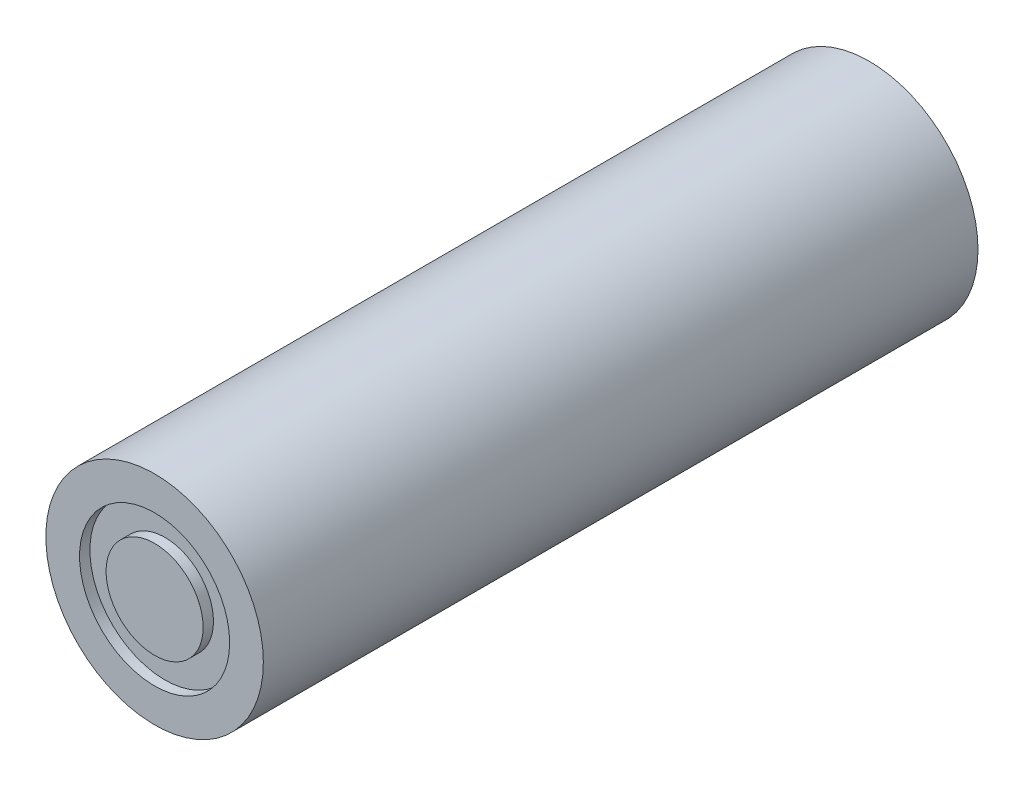
from build123d import *

# Parameters (mm, degrees)
SKETCH1_R           = 10.674999986
BOSS_EXTRUDE1_DEPTH = 35.075
SKETCH2_R           = 7.366
SKETCH2_R_2         = 4.7625
CUT_EXTRUDE1_DEPTH  = 1.016


with BuildPart() as part:
    # Sketch1 → Boss-Extrude1 (new, symmetric)
    with BuildSketch(Plane.XY):
        Circle(SKETCH1_R)
    extrude(amount=BOSS_EXTRUDE1_DEPTH, both=True)

    # Sketch2 → Cut-Extrude1 (cut)
    with BuildSketch(Plane.XY.offset(35.075)):
        Circle(SKETCH2_R)
        Circle(SKETCH2_R_2, mode=Mode.SUBTRACT)
    extrude(amount=-CUT_EXTRUDE1_DEPTH, mode=Mode.SUBTRACT)


solid = part.part
